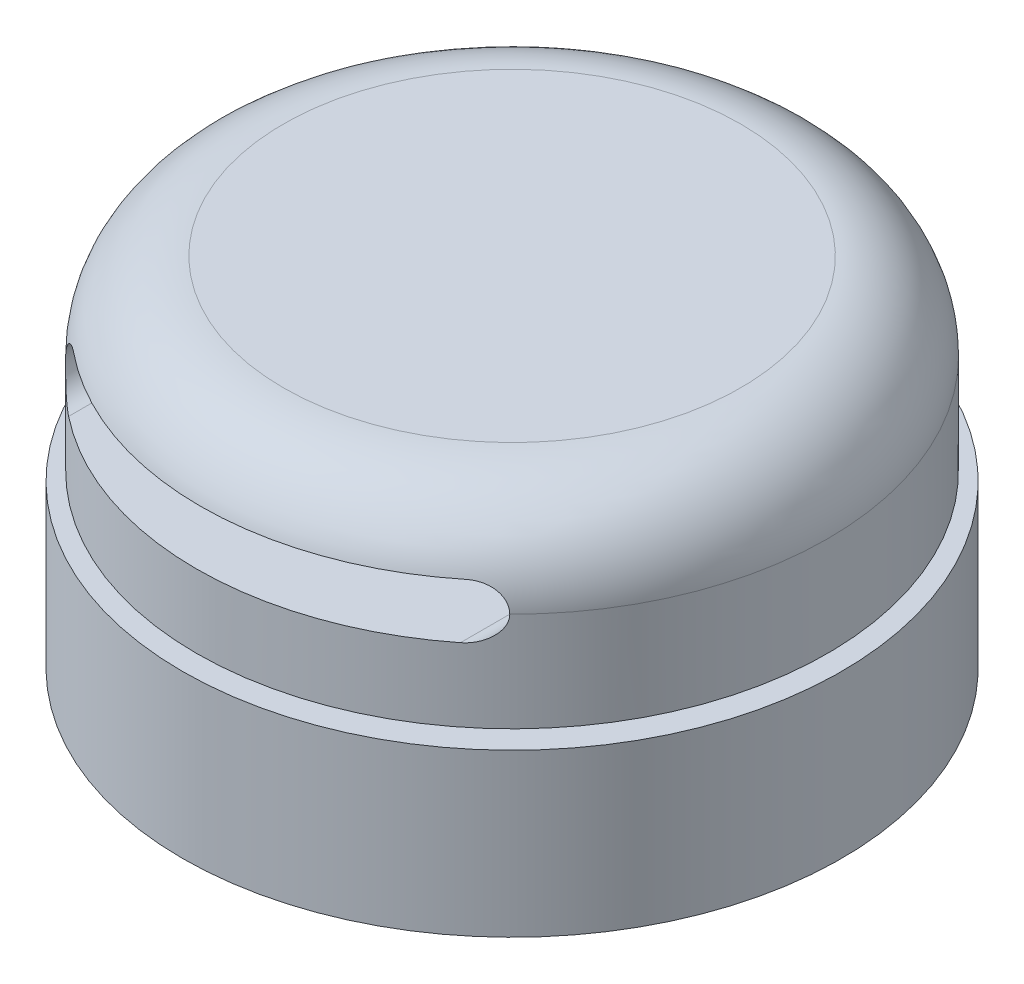
from build123d import *

# Parameters (mm, degrees)
SKETCH_2_R               = 1.5
CUT_EXTRUDE_1_DEPTH      = 1
PATTERN_CIRCULAR_1_COUNT = 4
FILLET_1_R               = 10
CUT_EXTRUDE_2_DEPTH      = 68.420234722


with BuildPart() as part:
    # 草图1 → 旋转1 (revolve)
    with BuildSketch(Plane.XY, mode=Mode.PRIVATE) as revolve_1_sk:
        Polygon((0, 0), (-37.845, 0), (-37.845, 18.6), (-34, 18.6), (-34, 19.6), (-36.25, 19.6), (-36.25, 41), (0, 41), align=None)
    revolve(revolve_1_sk.sketch.rotate(Axis((0, 49.444830204, 0), (0, -1, 0)), 270), axis=Axis((0, 49.444830204, 0), (0, -1, 0)))

    # 草图2 → 切除-拉伸1 (cut)
    with BuildSketch(Plane.XZ):
        with Locations(Location((0, 29.5, 0), (0, 0, 270))):
            Circle(SKETCH_2_R)
    extrude(amount=-CUT_EXTRUDE_1_DEPTH, mode=Mode.SUBTRACT)

    # 草图4 → g (revolve, cut)
    with BuildSketch(Plane(origin=(-20.859650045, 0, 20.859650045), x_dir=(0, 0, -1), z_dir=(1, 0, 0))):
        Polygon((0, 0), (0, 8.251075774), (1.25, 7.5), (1.25, 0), align=None)
    hole_wizard_g = revolve(axis=Axis((-20.859650045, -6.35, 20.859650045), (0, 1, 0)), mode=Mode.SUBTRACT)

    # 阵列(圆周)1: g ×4 about axis
    pattern_circular_1_axis = Axis((0, 0, 0), (0, 1, 0))
    for i in range(1, PATTERN_CIRCULAR_1_COUNT):
        add(hole_wizard_g.rotate(pattern_circular_1_axis, i * 360 / PATTERN_CIRCULAR_1_COUNT), mode=Mode.SUBTRACT)

    # 圆角1
    fillet_1_edges = [part.edges().sort_by_distance(p)[0] for p in [
        (0, 41, -36.25),
    ]]
    fillet(fillet_1_edges, radius=FILLET_1_R)

    # 草图5 → 切除-拉伸2 (cut, through all)
    with BuildSketch(Plane.XY):
        with BuildLine():
            Line((-22.5, 34), (22.5, 34))
            ThreePointArc((22.5, 34), (25.5, 31), (22.5, 28))
            Line((22.5, 28), (-22.5, 28))
            ThreePointArc((-22.5, 28), (-25.5, 31), (-22.5, 34))
        make_face()
    extrude(amount=CUT_EXTRUDE_2_DEPTH, mode=Mode.SUBTRACT)


solid = part.part
